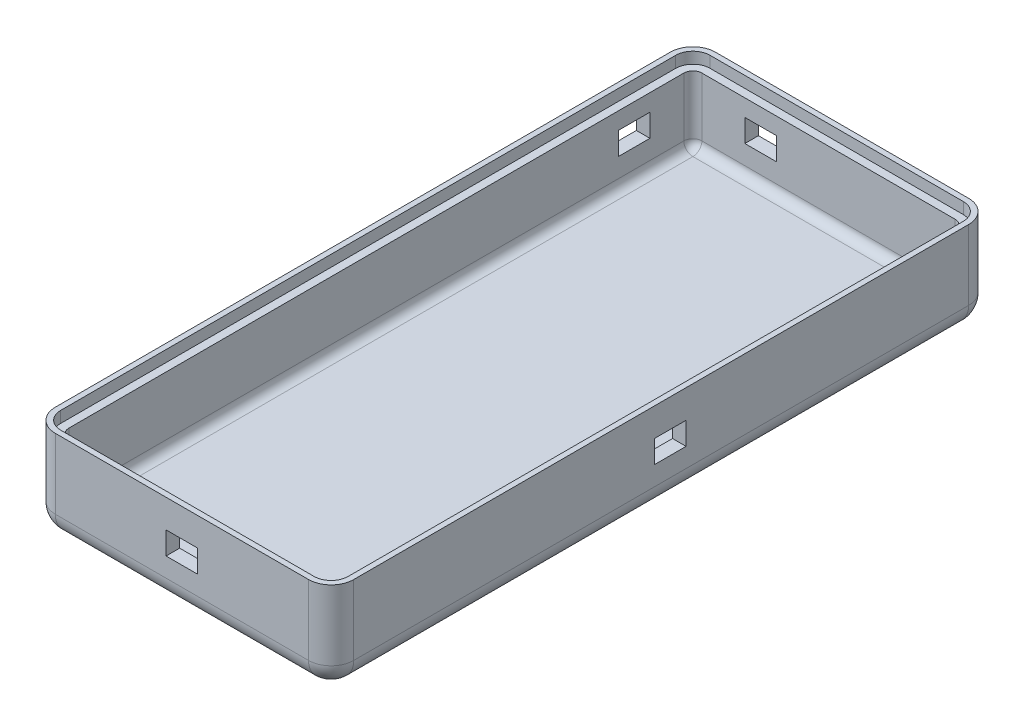
from build123d import *

# Parameters (mm, degrees)
ESBO_O1_W                = 60
ESBO_O1_H                = 140
RESSALTO_EXTRUS_O1_DEPTH = 15
FILETE1_R                = 2
CASCA1_T                 = 3
RESSALTO_EXTRUS_O2_START = 2.5
RESSALTO_EXTRUS_O2_DEPTH = 2.5
CORTE_EXTRUS_O1_REACH    = 101.956
ESBO_O4_W                = 7
ESBO_O4_H                = 5
CORTE_EXTRUS_O2_REACH    = 152.703
ESBO_O5_W                = 7
ESBO_O5_H                = 5
CORTE_EXTRUS_O3_REACH    = 101.956
ESBO_O6_W                = 7
ESBO_O6_H                = 5
CORTE_EXTRUS_O4_REACH    = 152.703
ESBO_O7_W                = 7
ESBO_O7_H                = 5


with BuildPart() as part:
    # Esboço1 → Ressalto-extrusão1 (new body)
    with BuildSketch(Plane(origin=(0, 0, 0), x_dir=(1, 0, 0), z_dir=(0, 1, 0))):
        Rectangle(ESBO_O1_W, ESBO_O1_H)
    extrude(amount=RESSALTO_EXTRUS_O1_DEPTH)

    # Filete1
    filete1_edges = [part.edges().sort_by_distance(p)[0] for p in [
        (0, 0, -70),
        (30, 0, 0),
        (0, 0, 70),
        (-30, 0, 0),
        (-30, 7.5, -70),
        (30, 7.5, -70),
        (30, 7.5, 70),
        (-30, 7.5, 70),
    ]]
    fillet(filete1_edges, radius=FILETE1_R)

    # Casca1
    casca1_openings = [part.faces().sort_by_distance(p)[0] for p in [
        (0, 15, 0),
    ]]
    offset(amount=CASCA1_T, openings=casca1_openings, kind=Kind.INTERSECTION)

    # Esboço3 → Ressalto-extrusão2 (add)
    with BuildSketch(Plane(origin=(0, 15, 0), x_dir=(1, 0, 0), z_dir=(0, 1, 0)).offset(RESSALTO_EXTRUS_O2_START)):
        with BuildLine():
            Line((28, 73), (-28, 73))
            ThreePointArc((-28, 73), (-31.535533906, 71.535533906), (-33, 68))
            Line((-33, 68), (-33, -68))
            ThreePointArc((-33, -68), (-31.535533906, -71.535533906), (-28, -73))
            Line((-28, -73), (28, -73))
            ThreePointArc((28, -73), (31.535533906, -71.535533906), (33, -68))
            Line((33, -68), (33, 68))
            ThreePointArc((33, 68), (31.535533906, 71.535533906), (28, 73))
        make_face()
        with BuildLine():
            Line((-31.8, 68), (-31.8, -68))
            ThreePointArc((-31.8, -68), (-30.687005769, -70.687005769), (-28, -71.8))
            Line((-28, -71.8), (28, -71.8))
            ThreePointArc((28, -71.8), (30.687005769, -70.687005769), (31.8, -68))
            Line((31.8, -68), (31.8, 68))
            ThreePointArc((31.8, 68), (30.687005769, 70.687005769), (28, 71.8))
            Line((28, 71.8), (-28, 71.8))
            ThreePointArc((-28, 71.8), (-30.687005769, 70.687005769), (-31.8, 68))
        make_face(mode=Mode.SUBTRACT)
    extrude(amount=-RESSALTO_EXTRUS_O2_DEPTH)

    # Esboço4 → Corte-extrusão1 (cut, up to next)
    with BuildSketch(Plane.ZY.offset(33), mode=Mode.PRIVATE) as corte_extrus_o1_sk1:
        with Locations((-57, 8.75)):
            Rectangle(ESBO_O4_W, ESBO_O4_H)
    corte_extrus_o1_tool1 = extrude(corte_extrus_o1_sk1.sketch, amount=-CORTE_EXTRUS_O1_REACH, mode=Mode.PRIVATE) & part.part
    add(corte_extrus_o1_tool1.solids().sort_by_distance((-33, 8.75, -57))[0], mode=Mode.SUBTRACT)

    # Esboço5 → Corte-extrusão2 (cut, up to next)
    with BuildSketch(Plane(origin=(0, 0, -73), x_dir=(-1, 0, 0), z_dir=(0, 0, -1)), mode=Mode.PRIVATE) as corte_extrus_o2_sk1:
        with Locations((15, 8.75)):
            Rectangle(ESBO_O5_W, ESBO_O5_H)
    corte_extrus_o2_tool1 = extrude(corte_extrus_o2_sk1.sketch, amount=-CORTE_EXTRUS_O2_REACH, mode=Mode.PRIVATE) & part.part
    add(corte_extrus_o2_tool1.solids().sort_by_distance((-15, 8.75, -73))[0], mode=Mode.SUBTRACT)

    # Esboço6 → Corte-extrusão3 (cut, up to next)
    with BuildSketch(Plane(origin=(33, 0, 0), x_dir=(0, 0, -1), z_dir=(1, 0, 0)), mode=Mode.PRIVATE) as corte_extrus_o3_sk1:
        with Locations((2, 8.75)):
            Rectangle(ESBO_O6_W, ESBO_O6_H)
    corte_extrus_o3_tool1 = extrude(corte_extrus_o3_sk1.sketch, amount=-CORTE_EXTRUS_O3_REACH, mode=Mode.PRIVATE) & part.part
    add(corte_extrus_o3_tool1.solids().sort_by_distance((33, 8.75, -2))[0], mode=Mode.SUBTRACT)

    # Esboço7 → Corte-extrusão4 (cut, up to next)
    with BuildSketch(Plane.XY.offset(73), mode=Mode.PRIVATE) as corte_extrus_o4_sk1:
        with Locations((0, 8.75)):
            Rectangle(ESBO_O7_W, ESBO_O7_H)
    corte_extrus_o4_tool1 = extrude(corte_extrus_o4_sk1.sketch, amount=-CORTE_EXTRUS_O4_REACH, mode=Mode.PRIVATE) & part.part
    add(corte_extrus_o4_tool1.solids().sort_by_distance((0, 8.75, 73))[0], mode=Mode.SUBTRACT)


solid = part.part
